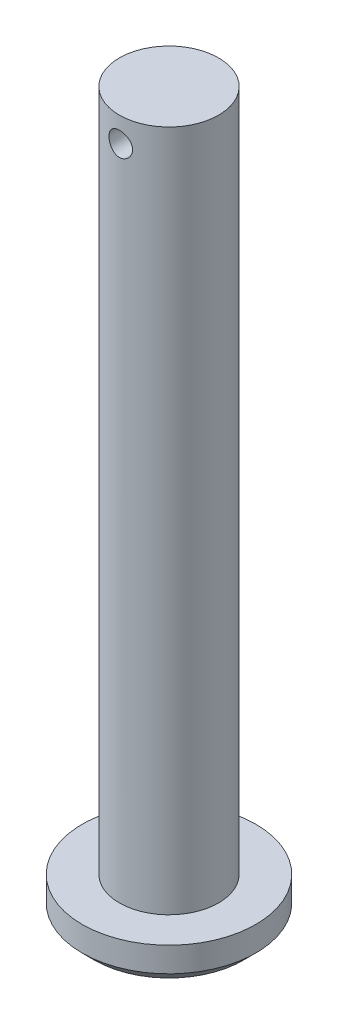
from build123d import *

# Parameters (mm, degrees)
SKETCH1_R           = 7
BOSS_EXTRUDE1_DEPTH = 3
SKETCH1_3_R         = 4
BOSS_EXTRUDE2_DEPTH = 55
SKETCH2_R           = 0.95
CUT_EXTRUDE1_DEPTH  = 57.524331044
CHAMFER1_SIZE       = 1


with BuildPart() as part:
    # Sketch1 → Boss-Extrude1 (new body)
    with BuildSketch(Plane(origin=(0, 0, 0), x_dir=(1, 0, 0), z_dir=(0, 1, 0))):
        Circle(SKETCH1_R)
    extrude(amount=-BOSS_EXTRUDE1_DEPTH)

    # Sketch1<3> → Boss-Extrude2 (add)
    with BuildSketch(Plane(origin=(0, 0, 0), x_dir=(1, 0, 0), z_dir=(0, 1, 0))):
        Circle(SKETCH1_3_R)
    extrude(amount=BOSS_EXTRUDE2_DEPTH)

    # Sketch2 → Cut-Extrude1 (cut, through all)
    with BuildSketch(Plane(origin=(0, 0, -4), x_dir=(-1, 0, 0), z_dir=(0, 0, -1))):
        with Locations((0, 53)):
            Circle(SKETCH2_R)
    extrude(amount=-CUT_EXTRUDE1_DEPTH, mode=Mode.SUBTRACT)

    # Chamfer1
    chamfer1_edges = [part.edges().sort_by_distance(p)[0] for p in [
        (-7, -3, 0),
    ]]
    chamfer(chamfer1_edges, length=CHAMFER1_SIZE)


solid = part.part
